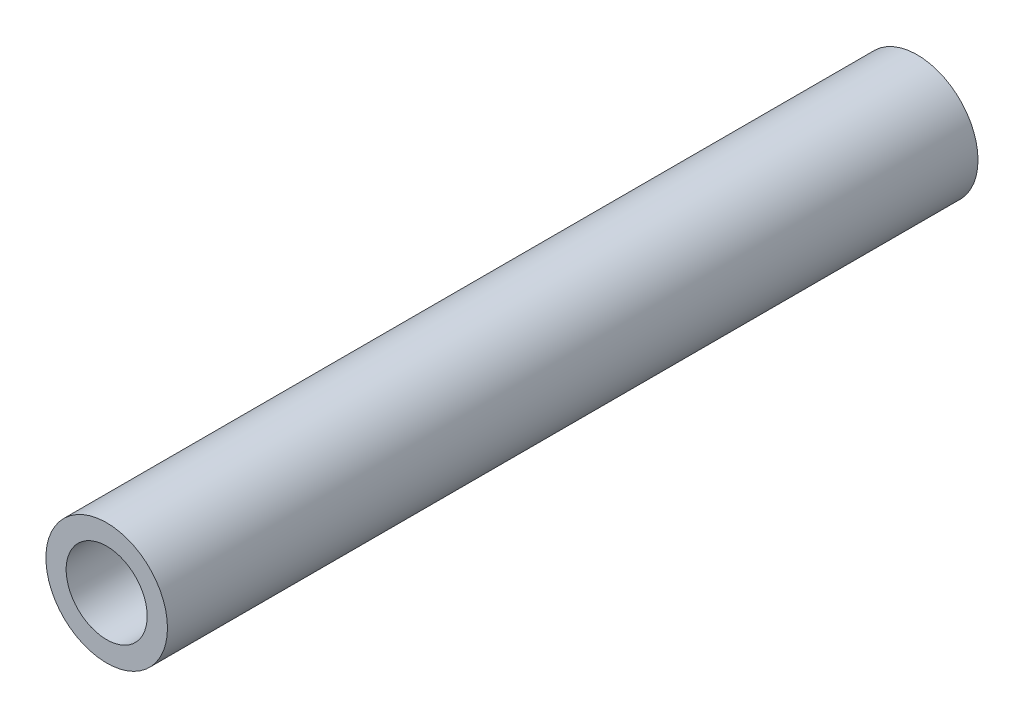
from build123d import *

# Parameters (mm, degrees)
SKICA1_R        = 3
VYSUNOUT1_DEPTH = 20


with BuildPart() as part:
    # Skica1 → Vysunout1 (new, symmetric)
    with BuildSketch(Plane.XY):
        Circle(SKICA1_R)
    extrude(amount=VYSUNOUT1_DEPTH, both=True)

    # Skica2 → Díra1 (revolve, cut)
    with BuildSketch(Plane(origin=(0, 0, 20), x_dir=(0, -1, 0), z_dir=(1, 0, 0))):
        Polygon((0, 0), (0, 5.201721238), (2, 4), (2, 0), align=None)
    d_ra1 = revolve(axis=Axis((0, 0, 24.244199587), (0, 0, -1)), mode=Mode.SUBTRACT)

    # Zrcadlit1: Díra1 across plane
    add(d_ra1.mirror(Plane.XY), mode=Mode.SUBTRACT)


solid = part.part
